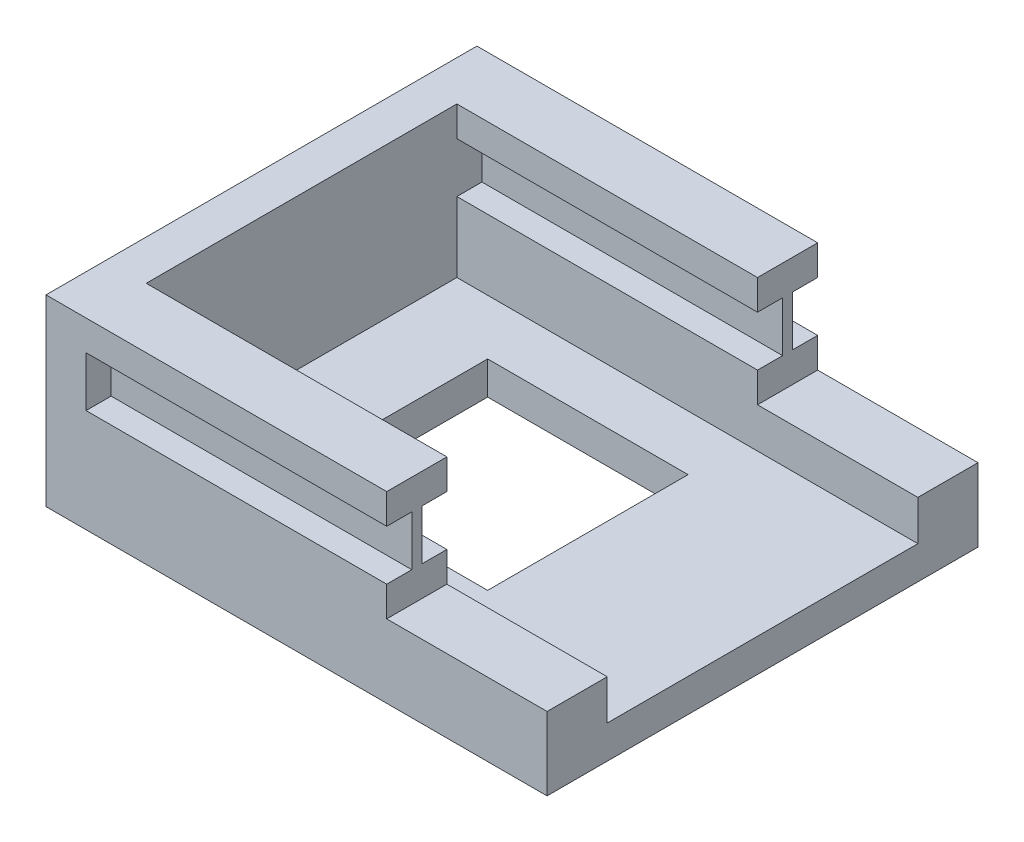
from build123d import *

# Parameters (mm, degrees)
BOSS_EXTRUDE1_DEPTH = 43
CUT_EXTRUDE1_START  = -6
SKETCH3_W           = 51
SKETCH3_H           = 4
CUT_EXTRUDE1_DEPTH  = 31
CUT_EXTRUDE2_REACH  = 74.18
SKETCH4_W           = 20
SKETCH4_H           = 20
BOSS_EXTRUDE2_START = -21
BOSS_EXTRUDE2_DEPTH = 30
CUT_EXTRUDE3_REACH  = 74.18
SKETCH6_W           = 5
SKETCH6_H           = 7.3


with BuildPart() as part:
    # Sketch1 → Boss-Extrude1 (new body)
    with BuildSketch(Plane.XY):
        Polygon((1, 15), (5, 15), (5, 4), (56, 4), (56, -3.3), (1, -3.3), align=None)
    extrude(amount=BOSS_EXTRUDE1_DEPTH)

    # Sketch3 → Cut-Extrude1 (cut)
    with BuildSketch(Plane.XY.offset(43).offset(CUT_EXTRUDE1_START)):
        with Locations((30.5, 2)):
            Rectangle(SKETCH3_W, SKETCH3_H)
    extrude(amount=-CUT_EXTRUDE1_DEPTH, mode=Mode.SUBTRACT)

    # Sketch4 → Cut-Extrude2 (cut, up to next)
    with BuildSketch(Plane(origin=(0, 0, 0), x_dir=(1, 0, 0), z_dir=(0, 1, 0)), mode=Mode.PRIVATE) as cut_extrude2_sk1:
        with Locations((23.57, -21.5)):
            Rectangle(SKETCH4_W, SKETCH4_H)
    cut_extrude2_tool1 = extrude(cut_extrude2_sk1.sketch, amount=-CUT_EXTRUDE2_REACH, mode=Mode.PRIVATE) & part.part
    add(cut_extrude2_tool1.solids().sort_by_distance((23.57, 0, 21.5))[0], mode=Mode.SUBTRACT)

    # Sketch5 → Boss-Extrude2 (add)
    with BuildSketch(Plane(origin=(56, 0, 0), x_dir=(0, 0, -1), z_dir=(1, 0, 0)).offset(BOSS_EXTRUDE2_START)):
        Polygon((-6, 7), (-6, 4), (0, 4), (0, 7), (-2.5, 7), (-2.5, 12), (0, 12), (0, 15), (-6, 15), (-6, 12), (-3.5, 12), (-3.5, 7), align=None)
        Polygon((-37, 4), (-37, 7), (-39.5, 7), (-39.5, 12), (-37, 12), (-37, 15), (-43, 15), (-43, 12), (-40.5, 12), (-40.5, 7), (-43, 7), (-43, 4), align=None)
    extrude(amount=-BOSS_EXTRUDE2_DEPTH)

    # Sketch6 → Cut-Extrude3 (cut, up to next)
    with BuildSketch(Plane(origin=(0, 0, 0), x_dir=(-1, 0, 0), z_dir=(0, 0, -1)), mode=Mode.PRIVATE) as cut_extrude3_sk1:
        with Locations((-53.5, 0.35)):
            Rectangle(SKETCH6_W, SKETCH6_H)
    cut_extrude3_tool1 = extrude(cut_extrude3_sk1.sketch, amount=-CUT_EXTRUDE3_REACH, mode=Mode.PRIVATE) & part.part
    add(cut_extrude3_tool1.solids().sort_by_distance((53.5, 0.35, 0))[0], mode=Mode.SUBTRACT)


solid = part.part
